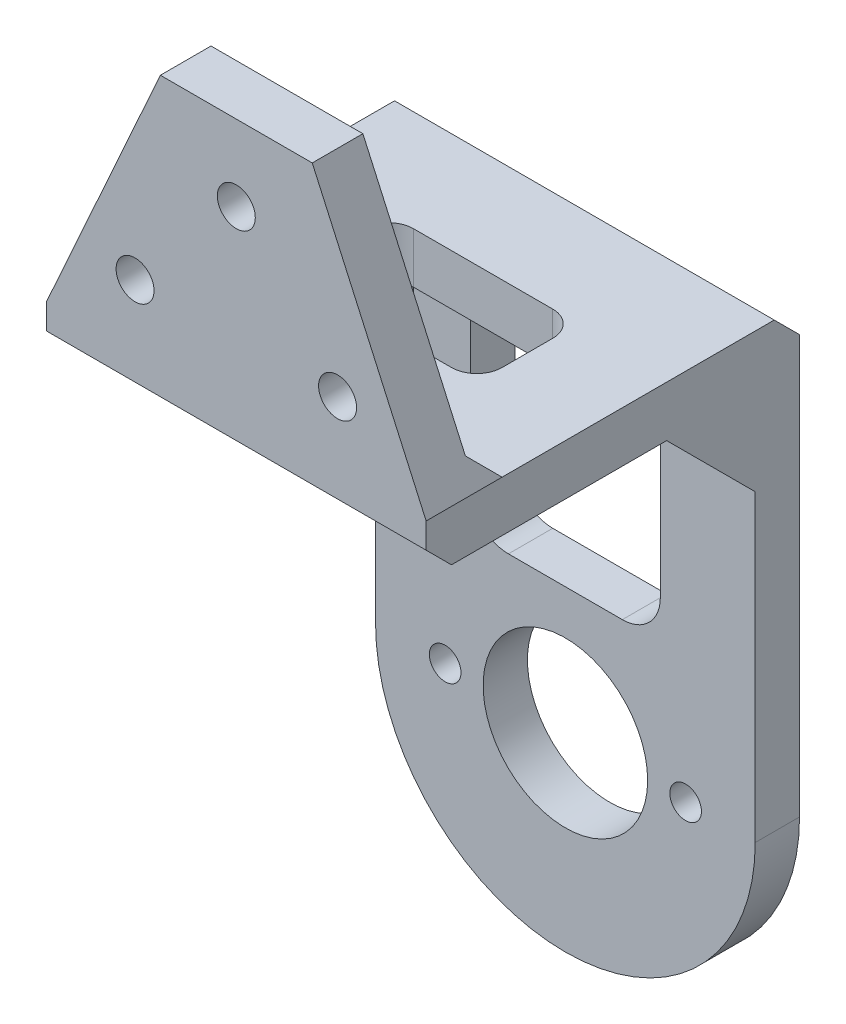
from build123d import *

# Parameters (mm, degrees)
SKETCH_1_R          = 6.5
SKETCH_1_W          = 15
SKETCH_1_H          = 18
EXTRUDE_1_DEPTH     = 3.5
HOLE_WIZARD_M3_1_D  = 2.5
FILLET_1_R          = 3
SKETCH_2_W          = 26
SKETCH_2_H          = 4
EXTRUDE_2_DEPTH     = 30
SKETCH_4_R          = 1.5
EXTRUDE_3_DEPTH     = 4
CHAMFER_1_SIZE      = 2
SKETCH_5_W          = 15
SKETCH_5_H          = 8
CUT_EXTRUDE_1_DEPTH = 10
FILLET_2_R          = 2
EXTRUDE_4_DEPTH     = 3
EXTRUDE_5_DEPTH     = 3


with BuildPart() as part:
    # 草图1 → 凸台-拉伸1 (new body)
    with BuildSketch(Plane.XY):
        with BuildLine():
            Line((-15, 35), (15, 35))
            Line((15, 35), (15, 0))
            ThreePointArc((15, 0), (0, -15), (-15, 0))
            Line((-15, 0), (-15, 35))
        make_face()
        Circle(SKETCH_1_R, mode=Mode.SUBTRACT)
        with Locations((0, 19)):
            Rectangle(SKETCH_1_W, SKETCH_1_H, mode=Mode.SUBTRACT)
    extrude(amount=EXTRUDE_1_DEPTH)

    # M3 螺纹孔1 (through all)
    with Locations(Plane.XY.offset(3.5)):
        with Locations((9.5, 0), (-9.5, 0)):
            Hole(HOLE_WIZARD_M3_1_D / 2)

    # 圆角1
    fillet_1_edges = [part.edges().sort_by_distance(p)[0] for p in [
        (-7.5, 10, 1.75),
        (7.5, 10, 1.75),
        (7.5, 28, 1.75),
        (-7.5, 28, 1.75),
    ]]
    fillet(fillet_1_edges, radius=FILLET_1_R)

    # 草图2 → 凸台-拉伸2 (add, through all)
    with BuildSketch(Plane(origin=(15, 0, 0), x_dir=(0, 0, -1), z_dir=(1, 0, 0))):
        with Locations((-16.5, 33)):
            Rectangle(SKETCH_2_W, SKETCH_2_H)
    extrude(amount=-EXTRUDE_2_DEPTH)

    # 草图4 → 凸台-拉伸3 (add)
    with BuildSketch(Plane.XY.offset(29.5)):
        Polygon((-15, 35), (-6, 55), (6, 55), (15, 35), align=None)
        with Locations((0, 49)):
            Circle(SKETCH_4_R, mode=Mode.SUBTRACT)
        with Locations((-8, 40)):
            Circle(SKETCH_4_R, mode=Mode.SUBTRACT)
        with Locations(Location((8, 40, 0), (0, 0, 180))):
            Circle(SKETCH_4_R, mode=Mode.SUBTRACT)
    extrude(amount=-EXTRUDE_3_DEPTH)

    # 倒角1
    chamfer_1_edges = [part.edges().sort_by_distance(p)[0] for p in [
        (0, 35, 0),
        (0, 31, 3.5),
        (0, 31, 29.5),
        (0, 35, 25.5),
    ]]
    chamfer(chamfer_1_edges, length=CHAMFER_1_SIZE)

    # 草图5 → 切除-拉伸1 (cut)
    with BuildSketch(Plane(origin=(0, 35, 0), x_dir=(1, 0, 0), z_dir=(0, 1, 0))):
        with Locations((0, -14)):
            Rectangle(SKETCH_5_W, SKETCH_5_H)
    extrude(amount=-CUT_EXTRUDE_1_DEPTH, mode=Mode.SUBTRACT)

    # 圆角2
    fillet_2_edges = [part.edges().sort_by_distance(p)[0] for p in [
        (-7.5, 33, 18),
        (-7.5, 33, 10),
        (7.5, 33, 10),
        (7.5, 33, 18),
    ]]
    fillet(fillet_2_edges, radius=FILLET_2_R)

    # 草图6 → 凸台-拉伸4 (add)
    with BuildSketch(Plane.ZY.offset(15)):
        Polygon((3.5, 24), (10.5, 31), (5.5, 31), (3.5, 29), align=None)
    extrude(amount=-EXTRUDE_4_DEPTH)

    # 草图7 → 凸台-拉伸5 (add)
    with BuildSketch(Plane(origin=(15, 0, 0), x_dir=(0, 0, -1), z_dir=(1, 0, 0))):
        Polygon((-3.5, 24), (-3.5, 29), (-5.5, 31), (-10.5, 31), align=None)
    extrude(amount=-EXTRUDE_5_DEPTH)


solid = part.part
